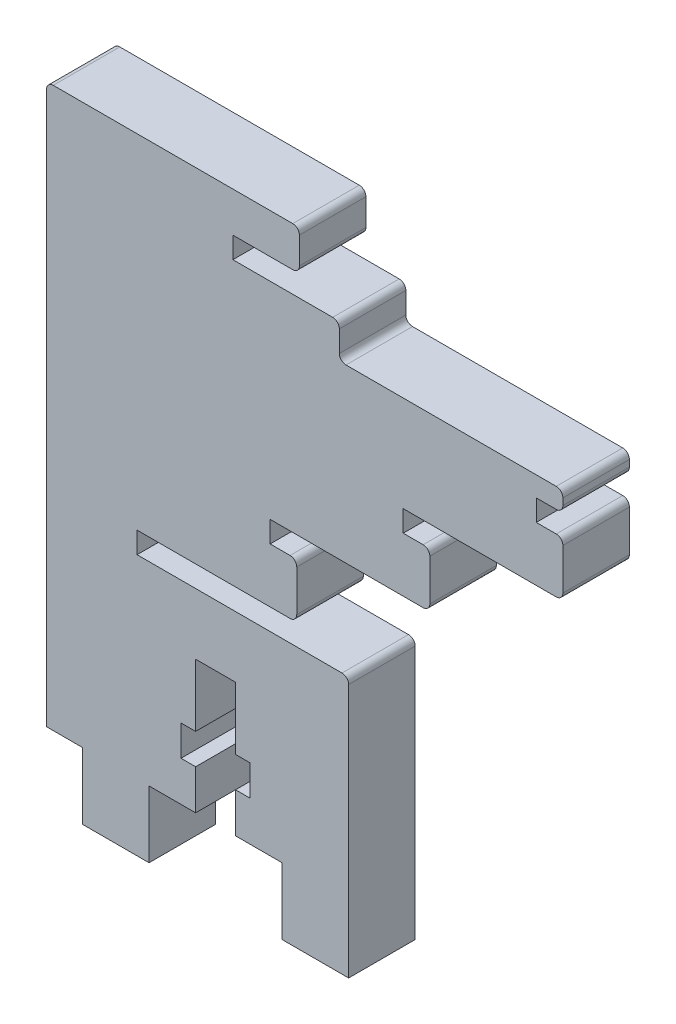
from build123d import *

# Parameters (mm, degrees)
BOSS_EXTRUDE1_DEPTH = 5
FILLET3_R           = 0.5


with BuildPart() as part:
    # Sketch1 → Boss-Extrude1 (new body)
    with BuildSketch(Plane.XY):
        Polygon((14.1, 25.3), (14.1, 26.9), (26.1, 26.9), (26.1, 31), (24.1, 31), (24.1, 32.6), (36.1, 32.6), (36.1, 36.7), (34.1, 36.7), (34.1, 38.3), (36.1, 38.3), (36.1, 39.8), (19.3, 39.8), (19.3, 42.4), (11.3, 42.4), (11.3, 44), (16.3, 44), (16.3, 47), (-2.7, 47), (-2.7, 5), (0, 5), (0, 0), (5, 0), (5, 5), (8.5, 5), (8.5, 8), (7.4, 8), (7.4, 10.3), (8.5, 10.3), (8.5, 15), (11.5, 15), (11.5, 10.3), (12.6, 10.3), (12.6, 8), (11.5, 8), (11.5, 5), (15, 5), (15, 0), (20, 0), (20, 5), (20, 19.6), (4.1, 19.6), (4.1, 21.2), (16.1, 21.2), (16.1, 25.3), align=None)
    extrude(amount=BOSS_EXTRUDE1_DEPTH)

    # Fillet3
    fillet3_edges = [part.edges().sort_by_distance(p)[0] for p in [
        (-2.7, 47, 2.5),
        (16.3, 47, 2.5),
        (16.3, 44, 2.5),
        (19.3, 42.4, 2.5),
        (19.3, 39.8, 2.5),
        (36.1, 39.8, 2.5),
        (36.1, 38.3, 2.5),
        (36.1, 36.7, 2.5),
        (36.1, 32.6, 2.5),
        (26.1, 31, 2.5),
        (26.1, 26.9, 2.5),
        (16.1, 25.3, 2.5),
        (16.1, 21.2, 2.5),
        (20, 19.6, 2.5),
    ]]
    fillet(fillet3_edges, radius=FILLET3_R)


solid = part.part
